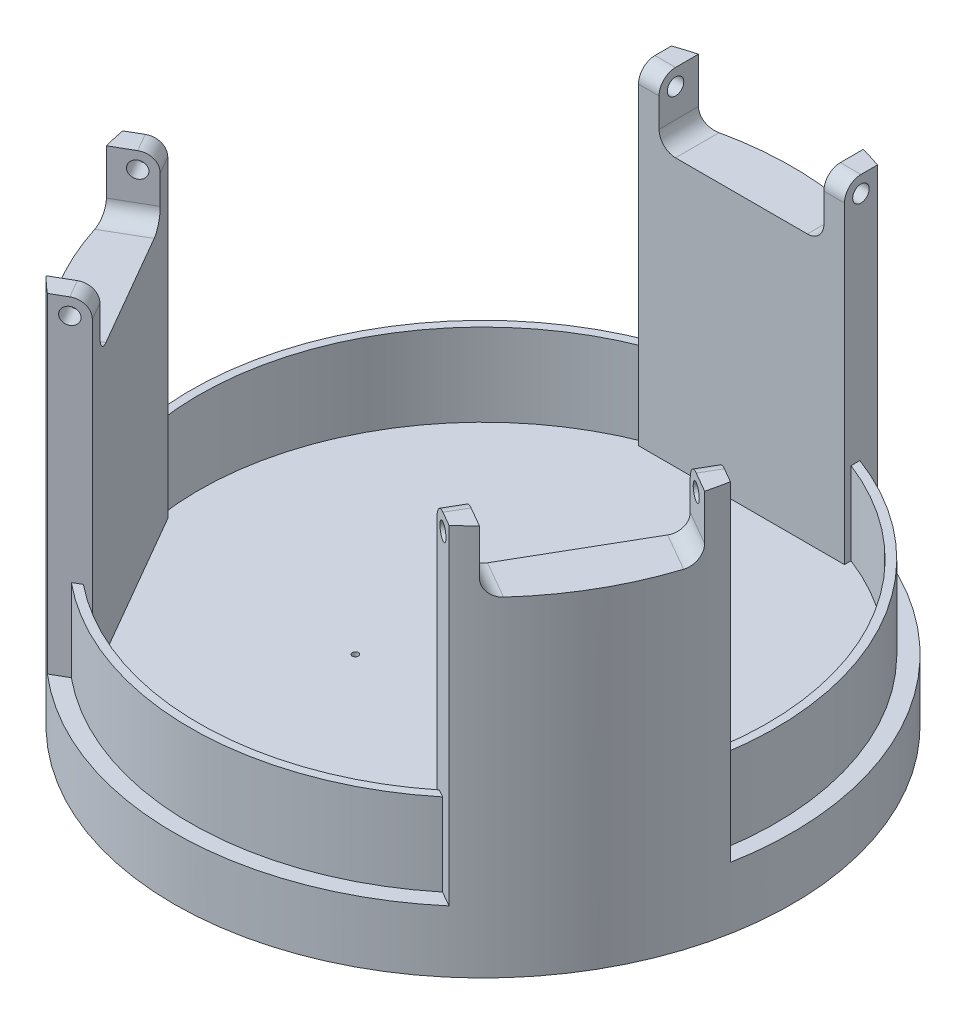
from build123d import *

# Parameters (mm, degrees)
SKETCH1_R                 = 75
BOSS_EXTRUDE1_DEPTH       = 15
BOSS_EXTRUDE2_DEPTH       = 80
CUT_EXTRUDE1_START        = -15
CUT_EXTRUDE1_DEPTH        = 15
F_4_0_MM_DOWEL_HOLES1_D   = 4
FILLET1_R                 = 4
FILLET2_R                 = 4
CIRPATTERN1_COUNT         = 3
FILLET1_OF_CIRPATTERN1_R  = 4
FILLET2_OF_CIRPATTERN1_R  = 4
FORI_ALESATO_1_5MM2_D     = 1.5
SCHIZZO8_R                = 71
SCHIZZO8_R_2              = 69
ESTRUSIONE_SOTTILE1_DEPTH = 20


with BuildPart() as part:
    # Sketch1 → Boss-Extrude1 (new body)
    with BuildSketch(Plane(origin=(0, 0, 0), x_dir=(1, 0, 0), z_dir=(0, 1, 0))):
        with Locations(Location((0, 0, 0), (0, 0, 270))):
            Circle(SKETCH1_R)
    extrude(amount=BOSS_EXTRUDE1_DEPTH)

    # Sketch2 → Boss-Extrude2 (add)
    with BuildSketch(Plane(origin=(0, 15, 0), x_dir=(1, 0, 0), z_dir=(0, 1, 0))):
        with BuildLine():
            Line((-25, 70.710678119), (-25, 62.710678119))
            Line((-25, 62.710678119), (25, 62.710678119))
            Line((25, 62.710678119), (25, 70.710678119))
            ThreePointArc((25, 70.710678119), (0, 75), (-25, 70.710678119))
        make_face()
    boss_extrude2 = extrude(amount=BOSS_EXTRUDE2_DEPTH)

    # Sketch3 → Cut-Extrude1 (cut)
    with BuildSketch(Plane(origin=(0, 95, 0), x_dir=(1, 0, 0), z_dir=(0, 1, 0)).offset(CUT_EXTRUDE1_START)):
        with BuildLine():
            Line((-20, 72.284161474), (-20, 62.710678119))
            Line((-20, 62.710678119), (20, 62.710678119))
            Line((20, 62.710678119), (20, 72.284161474))
            ThreePointArc((20, 72.284161474), (0, 75), (-20, 72.284161474))
        make_face()
    cut_extrude1 = extrude(amount=CUT_EXTRUDE1_DEPTH, mode=Mode.SUBTRACT)

    # Ø4.0 mm Dowel Holes1 (through all)
    with Locations(Plane(origin=(25, 0, 0), x_dir=(0, 0, -1), z_dir=(1, 0, 0))):
        with Locations((66.710678119, 91)):
            f_4_0_mm_dowel_holes1 = Hole(F_4_0_MM_DOWEL_HOLES1_D / 2)

    # Fillet1
    fillet1_edges = [part.edges().sort_by_distance(p)[0] for p in [
        (22.5, 95, -62.710678119),
        (-22.5, 95, -62.710678119),
    ]]
    fillet(fillet1_edges, radius=FILLET1_R)

    # Fillet2
    fillet2_edges = [part.edges().sort_by_distance(p)[0] for p in [
        (20, 80, -67.497419796),
        (-20, 80, -67.497419796),
    ]]
    fillet(fillet2_edges, radius=FILLET2_R)

    # CirPattern1: Boss-Extrude2, Cut-Extrude1, Ø4.0 mm Dowel Holes1 ×3 about axis
    cirpattern1_axis = Axis((0, 0, 0), (0, 1, 0))
    add([boss_extrude2.rotate(cirpattern1_axis, i * 360 / CIRPATTERN1_COUNT) for i in range(1, CIRPATTERN1_COUNT)])
    add([cut_extrude1.rotate(cirpattern1_axis, i * 360 / CIRPATTERN1_COUNT) for i in range(1, CIRPATTERN1_COUNT)], mode=Mode.SUBTRACT)
    add([f_4_0_mm_dowel_holes1.rotate(cirpattern1_axis, i * 360 / CIRPATTERN1_COUNT) for i in range(1, CIRPATTERN1_COUNT)], mode=Mode.SUBTRACT)

    # Fillet1 of CirPattern1
    fillet1_of_cirpattern1_edges = [part.edges().sort_by_distance(p)[0] for p in [
        (-65.559040339, 95, 11.869767474),
        (-43.059040339, 95, 50.840910644),
        (43.059040339, 95, 50.840910644),
        (65.559040339, 95, 11.869767474),
    ]]
    fillet(fillet1_of_cirpattern1_edges, radius=FILLET1_OF_CIRPATTERN1_R)

    # Fillet2 of CirPattern1
    fillet2_of_cirpattern1_edges = [part.edges().sort_by_distance(p)[0] for p in [
        (-68.454480234, 80, 16.428201822),
        (-48.454480234, 80, 51.069217974),
        (48.454480234, 80, 51.069217974),
        (68.454480234, 80, 16.428201822),
    ]]
    fillet(fillet2_of_cirpattern1_edges, radius=FILLET2_OF_CIRPATTERN1_R)

    # Fori Alesato Ø1.5mm2 (through all)
    with Locations(Plane(origin=(0, 0, 0), x_dir=(-1, 0, 0), z_dir=(0, -1, 0))):
        with Locations((-15.499780644, 15.499780644), (15.499780644, -15.499780644), (-15.499780644, -15.499780644), (15.499780644, 15.499780644)):
            Hole(FORI_ALESATO_1_5MM2_D / 2)

    # Schizzo8 → Estrusione-Sottile1 (add)
    with BuildSketch(Plane(origin=(0, 15, 0), x_dir=(1, 0, 0), z_dir=(0, 1, 0))):
        Circle(SCHIZZO8_R)
        Circle(SCHIZZO8_R_2, mode=Mode.SUBTRACT)
    extrude(amount=ESTRUSIONE_SOTTILE1_DEPTH)


solid = part.part
